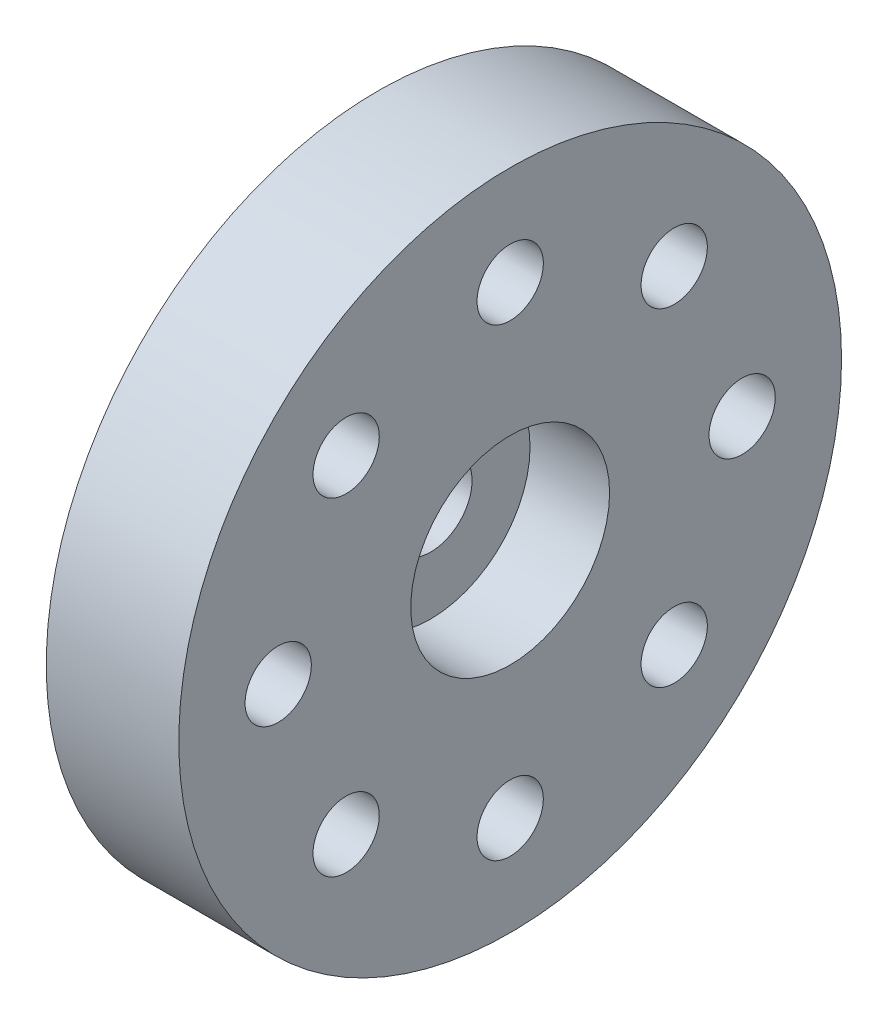
from build123d import *
from build123d.topology import SkipClean

# Parameters (mm, degrees)
SKETCH_1_R               = 10
EXTRUDE_1_DEPTH          = 4
SKETCH_3_R               = 3
CUT_EXTRUDE_1_DEPTH      = 15.696938457
SKETCH_5_R               = 1
CUT_EXTRUDE_2_DEPTH      = 15.696938457
PATTERN_CIRCULAR_1_COUNT = 8
SKETCH_6_R               = 3.5
SKETCH_6_R_2             = 3
EXTRUDE_3_DEPTH          = 0.5
FILLET_3_R               = 0.2
EXTRUDE_START            = -1.6
SKETCH_7_R               = 3.5
SKETCH_7_R_2             = 1.25
EXTRUDE_4_DEPTH          = 1.6


with BuildPart() as part:
    # 草图1 → 凸台-拉伸1 (new body)
    with BuildSketch(Plane(origin=(0, 0, 0), x_dir=(0, 0, -1), z_dir=(1, 0, 0))):
        Circle(SKETCH_1_R)
    extrude(amount=EXTRUDE_1_DEPTH)

    # 草图3 → 切除-拉伸1 (cut, through all)
    with BuildSketch(Plane(origin=(4, 0, 0), x_dir=(0, 0, -1), z_dir=(1, 0, 0))):
        Circle(SKETCH_3_R)
    extrude(amount=-CUT_EXTRUDE_1_DEPTH, mode=Mode.SUBTRACT)

    # 草图5 → 切除-拉伸2 (cut, through all)
    with BuildSketch(Plane.ZY):
        with Locations((0, 7)):
            Circle(SKETCH_5_R)
    cut_extrude_2 = extrude(amount=-CUT_EXTRUDE_2_DEPTH, mode=Mode.SUBTRACT)

    # 阵列(圆周)1: 切除-拉伸2 ×8 about axis
    pattern_circular_1_axis = Axis((0, 0, 0), (1, 0, 0))
    for i in range(1, PATTERN_CIRCULAR_1_COUNT):
        add(cut_extrude_2.rotate(pattern_circular_1_axis, i * 360 / PATTERN_CIRCULAR_1_COUNT), mode=Mode.SUBTRACT)

    # 草图6 → 凸台-拉伸3 (add)
    with SkipClean():  # the faces are left unmerged after this step: merging them gives an invalid solid
        with BuildSketch(Plane.ZY):
            Circle(SKETCH_6_R)
            Circle(SKETCH_6_R_2, mode=Mode.SUBTRACT)
        extrude(amount=EXTRUDE_3_DEPTH)

    # 圆角3
    fillet_3_edges = [part.edges().sort_by_distance(p)[0] for p in [
        (-0.5, 0, -3),
        (-0.5, 0, -3.5),
    ]]
    fillet(fillet_3_edges, radius=FILLET_3_R)

    # 草图7 → 凸台-拉伸4 (add)
    with BuildSketch(Plane.ZY.offset(EXTRUDE_START)):
        Circle(SKETCH_7_R)
        Circle(SKETCH_7_R_2, mode=Mode.SUBTRACT)
    extrude(amount=EXTRUDE_4_DEPTH)


solid = part.part
